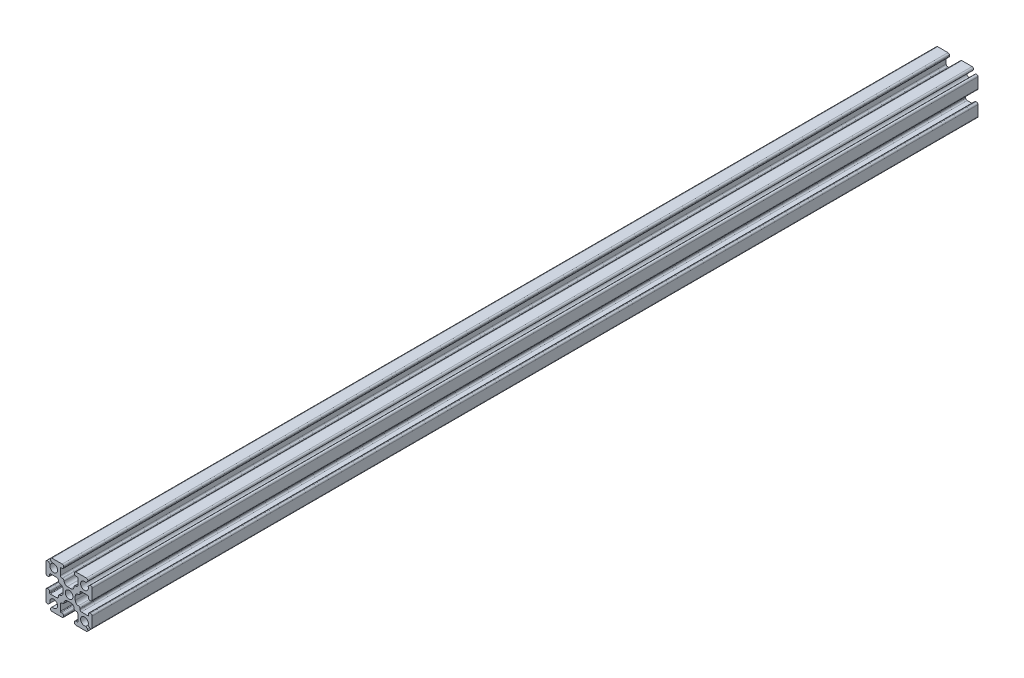
from build123d import *

# Parameters (mm, degrees)
SKETCH1_R           = 1.25
BOSS_EXTRUDE1_DEPTH = 287.782


with BuildPart() as part:
    # Sketch1 → Boss-Extrude1 (new body)
    with BuildSketch(Plane.XY):
        with BuildLine():
            Line((6.646446609, 5.939339828), (6.163645978, 5.456539197))
            ThreePointArc((6.163645978, 5.456539197), (4.116116524, 4.116116524), (5.456539197, 6.163645978))
            Line((5.456539197, 6.163645978), (5.939339828, 6.646446609))
            ThreePointArc((5.939339828, 6.646446609), (6.047726204, 7.191341716), (5.585786438, 7.5))
            Line((5.585786438, 7.5), (2.25, 7.5))
            ThreePointArc((2.25, 7.5), (1.896446609, 7.353553391), (1.75, 7))
            Line((1.75, 7), (1.75, 6.8))
            ThreePointArc((1.75, 6.8), (1.896446609, 6.446446609), (2.25, 6.3))
            Line((2.25, 6.3), (2.65, 6.3))
            ThreePointArc((2.65, 6.3), (2.791421356, 6.241421356), (2.85, 6.1))
            Line((2.85, 6.1), (2.85, 4))
            ThreePointArc((2.85, 4), (2.703553391, 3.646446609), (2.35, 3.5))
            Line((2.35, 3.5), (2.1, 3.5))
            ThreePointArc((2.1, 3.5), (1.746446609, 3.353553391), (1.6, 3))
            ThreePointArc((1.6, 3), (1.307106781, 2.292893219), (0.6, 2))
            Line((0.6, 2), (-0.6, 2))
            ThreePointArc((-0.6, 2), (-1.307106781, 2.292893219), (-1.6, 3))
            ThreePointArc((-1.6, 3), (-1.746446609, 3.353553391), (-2.1, 3.5))
            Line((-2.1, 3.5), (-2.35, 3.5))
            ThreePointArc((-2.35, 3.5), (-2.703553391, 3.646446609), (-2.85, 4))
            Line((-2.85, 4), (-2.85, 6.1))
            ThreePointArc((-2.85, 6.1), (-2.791421356, 6.241421356), (-2.65, 6.3))
            Line((-2.65, 6.3), (-2.25, 6.3))
            ThreePointArc((-2.25, 6.3), (-1.896446609, 6.446446609), (-1.75, 6.8))
            Line((-1.75, 6.8), (-1.75, 7))
            ThreePointArc((-1.75, 7), (-1.896446609, 7.353553391), (-2.25, 7.5))
            Line((-2.25, 7.5), (-5.585786438, 7.5))
            ThreePointArc((-5.585786438, 7.5), (-6.047726204, 7.191341716), (-5.939339828, 6.646446609))
            Line((-5.939339828, 6.646446609), (-5.456539197, 6.163645978))
            ThreePointArc((-5.456539197, 6.163645978), (-4.116116524, 4.116116524), (-6.163645978, 5.456539197))
            Line((-6.163645978, 5.456539197), (-6.646446609, 5.939339828))
            ThreePointArc((-6.646446609, 5.939339828), (-7.191341716, 6.047726204), (-7.5, 5.585786438))
            Line((-7.5, 5.585786438), (-7.5, 2.25))
            ThreePointArc((-7.5, 2.25), (-7.353553391, 1.896446609), (-7, 1.75))
            Line((-7, 1.75), (-6.8, 1.75))
            ThreePointArc((-6.8, 1.75), (-6.446446609, 1.896446609), (-6.3, 2.25))
            Line((-6.3, 2.25), (-6.3, 2.65))
            ThreePointArc((-6.3, 2.65), (-6.241421356, 2.791421356), (-6.1, 2.85))
            Line((-6.1, 2.85), (-4, 2.85))
            ThreePointArc((-4, 2.85), (-3.646446609, 2.703553391), (-3.5, 2.35))
            Line((-3.5, 2.35), (-3.5, 2.1))
            ThreePointArc((-3.5, 2.1), (-3.353553391, 1.746446609), (-3, 1.6))
            ThreePointArc((-3, 1.6), (-2.292893219, 1.307106781), (-2, 0.6))
            Line((-2, 0.6), (-2, -0.6))
            ThreePointArc((-2, -0.6), (-2.292893219, -1.307106781), (-3, -1.6))
            ThreePointArc((-3, -1.6), (-3.353553391, -1.746446609), (-3.5, -2.1))
            Line((-3.5, -2.1), (-3.5, -2.35))
            ThreePointArc((-3.5, -2.35), (-3.646446609, -2.703553391), (-4, -2.85))
            Line((-4, -2.85), (-6.1, -2.85))
            ThreePointArc((-6.1, -2.85), (-6.241421356, -2.791421356), (-6.3, -2.65))
            Line((-6.3, -2.65), (-6.3, -2.25))
            ThreePointArc((-6.3, -2.25), (-6.446446609, -1.896446609), (-6.8, -1.75))
            Line((-6.8, -1.75), (-7, -1.75))
            ThreePointArc((-7, -1.75), (-7.353553391, -1.896446609), (-7.5, -2.25))
            Line((-7.5, -2.25), (-7.5, -5.585786438))
            ThreePointArc((-7.5, -5.585786438), (-7.191341716, -6.047726204), (-6.646446609, -5.939339828))
            Line((-6.646446609, -5.939339828), (-6.163645978, -5.456539197))
            ThreePointArc((-6.163645978, -5.456539197), (-4.116116524, -4.116116524), (-5.456539197, -6.163645978))
            Line((-5.456539197, -6.163645978), (-5.939339828, -6.646446609))
            ThreePointArc((-5.939339828, -6.646446609), (-6.047726204, -7.191341716), (-5.585786438, -7.5))
            Line((-5.585786438, -7.5), (-2.25, -7.5))
            ThreePointArc((-2.25, -7.5), (-1.896446609, -7.353553391), (-1.75, -7))
            Line((-1.75, -7), (-1.75, -6.8))
            ThreePointArc((-1.75, -6.8), (-1.896446609, -6.446446609), (-2.25, -6.3))
            Line((-2.25, -6.3), (-2.65, -6.3))
            ThreePointArc((-2.65, -6.3), (-2.791421356, -6.241421356), (-2.85, -6.1))
            Line((-2.85, -6.1), (-2.85, -4))
            ThreePointArc((-2.85, -4), (-2.703553391, -3.646446609), (-2.35, -3.5))
            Line((-2.35, -3.5), (-2.1, -3.5))
            ThreePointArc((-2.1, -3.5), (-1.746446609, -3.353553391), (-1.6, -3))
            ThreePointArc((-1.6, -3), (-1.307106781, -2.292893219), (-0.6, -2))
            Line((-0.6, -2), (0.6, -2))
            ThreePointArc((0.6, -2), (1.307106781, -2.292893219), (1.6, -3))
            ThreePointArc((1.6, -3), (1.746446609, -3.353553391), (2.1, -3.5))
            Line((2.1, -3.5), (2.35, -3.5))
            ThreePointArc((2.35, -3.5), (2.703553391, -3.646446609), (2.85, -4))
            Line((2.85, -4), (2.85, -6.1))
            ThreePointArc((2.85, -6.1), (2.791421356, -6.241421356), (2.65, -6.3))
            Line((2.65, -6.3), (2.25, -6.3))
            ThreePointArc((2.25, -6.3), (1.896446609, -6.446446609), (1.75, -6.8))
            Line((1.75, -6.8), (1.75, -7))
            ThreePointArc((1.75, -7), (1.896446609, -7.353553391), (2.25, -7.5))
            Line((2.25, -7.5), (5.585786438, -7.5))
            ThreePointArc((5.585786438, -7.5), (6.047726204, -7.191341716), (5.939339828, -6.646446609))
            Line((5.939339828, -6.646446609), (5.456539197, -6.163645978))
            ThreePointArc((5.456539197, -6.163645978), (4.116116524, -4.116116524), (6.163645978, -5.456539197))
            Line((6.163645978, -5.456539197), (6.646446609, -5.939339828))
            ThreePointArc((6.646446609, -5.939339828), (7.191341716, -6.047726204), (7.5, -5.585786438))
            Line((7.5, -5.585786438), (7.5, -2.25))
            ThreePointArc((7.5, -2.25), (7.353553391, -1.896446609), (7, -1.75))
            Line((7, -1.75), (6.8, -1.75))
            ThreePointArc((6.8, -1.75), (6.446446609, -1.896446609), (6.3, -2.25))
            Line((6.3, -2.25), (6.3, -2.65))
            ThreePointArc((6.3, -2.65), (6.241421356, -2.791421356), (6.1, -2.85))
            Line((6.1, -2.85), (4, -2.85))
            ThreePointArc((4, -2.85), (3.646446609, -2.703553391), (3.5, -2.35))
            Line((3.5, -2.35), (3.5, -2.1))
            ThreePointArc((3.5, -2.1), (3.353553391, -1.746446609), (3, -1.6))
            ThreePointArc((3, -1.6), (2.292893219, -1.307106781), (2, -0.6))
            Line((2, -0.6), (2, 0.6))
            ThreePointArc((2, 0.6), (2.292893219, 1.307106781), (3, 1.6))
            ThreePointArc((3, 1.6), (3.353553391, 1.746446609), (3.5, 2.1))
            Line((3.5, 2.1), (3.5, 2.35))
            ThreePointArc((3.5, 2.35), (3.646446609, 2.703553391), (4, 2.85))
            Line((4, 2.85), (6.1, 2.85))
            ThreePointArc((6.1, 2.85), (6.241421356, 2.791421356), (6.3, 2.65))
            Line((6.3, 2.65), (6.3, 2.25))
            ThreePointArc((6.3, 2.25), (6.446446609, 1.896446609), (6.8, 1.75))
            Line((6.8, 1.75), (7, 1.75))
            ThreePointArc((7, 1.75), (7.353553391, 1.896446609), (7.5, 2.25))
            Line((7.5, 2.25), (7.5, 5.585786438))
            ThreePointArc((7.5, 5.585786438), (7.191341716, 6.047726204), (6.646446609, 5.939339828))
        make_face()
        with Locations(Location((0, 0, 0), (0, 0, 180))):
            Circle(SKETCH1_R, mode=Mode.SUBTRACT)
    extrude(amount=BOSS_EXTRUDE1_DEPTH)


solid = part.part
